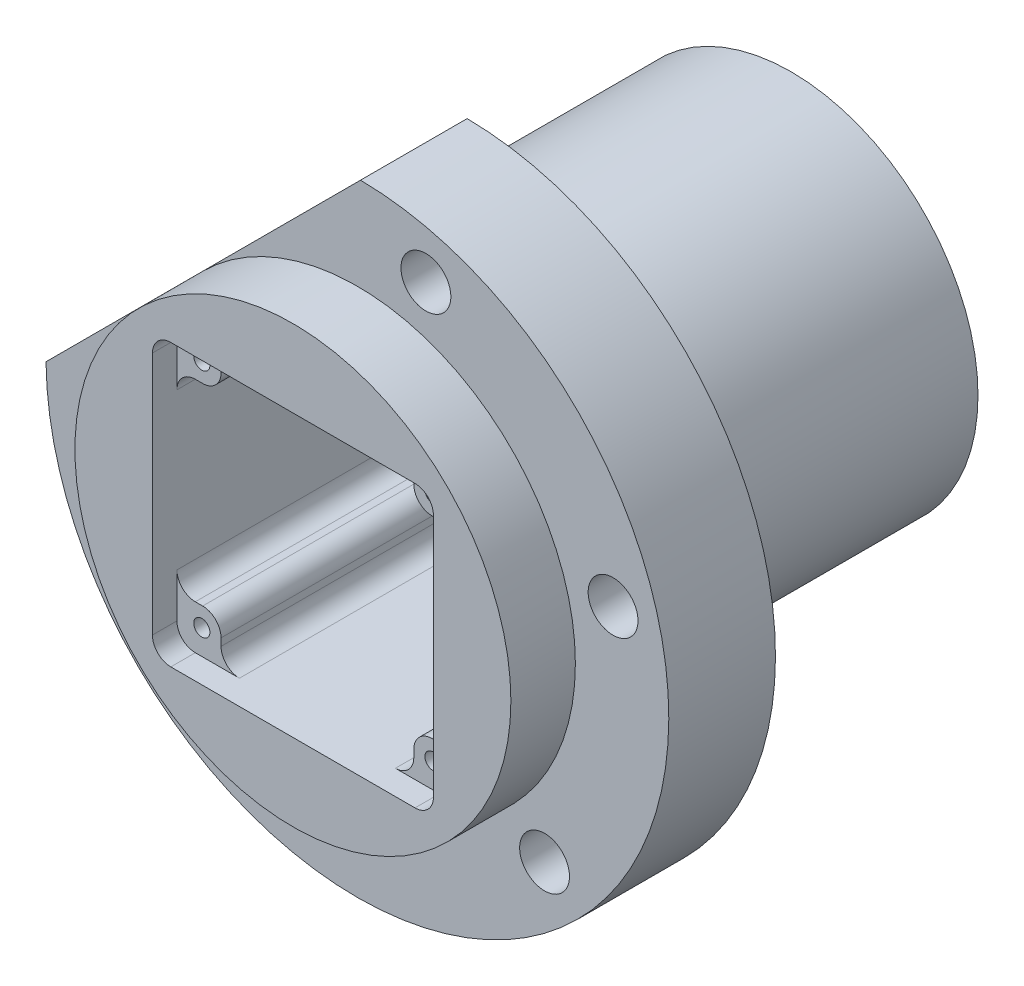
from build123d import *

# Parameters (mm, degrees)
SKETCH1_R                                     = 63.5
BOSS_EXTRUDE1_DEPTH                           = 6.35
BOSS_EXTRUDE2_START                           = 19.5
SKETCH1_3_R                                   = 44.45
BOSS_EXTRUDE2_DEPTH                           = 101.6
CUT_EXTRUDE1_DEPTH                            = 136.598893801
FILLET1_R                                     = 3.75
CUT_EXTRUDE2_DEPTH                            = 5
SKETCH4_R                                     = 63.5
SKETCH4_R_2                                   = 44.45
BOSS_EXTRUDE3_DEPTH                           = 15.4
CSK_FOR_8_FLAT_HEAD_MACHINE_SCREW1_AT_2_COUNT = 2
CSK_FOR_8_FLAT_HEAD_MACHINE_SCREW1_AT_2_PITCH = 53.975
CSK_FOR_8_FLAT_HEAD_MACHINE_SCREW1_AT_3_COUNT = 2
CSK_FOR_8_FLAT_HEAD_MACHINE_SCREW1_AT_3_PITCH = 93.487442339
CSK_FOR_8_FLAT_HEAD_MACHINE_SCREW1_AT_4_COUNT = 2
CSK_FOR_8_FLAT_HEAD_MACHINE_SCREW1_AT_4_PITCH = 107.95
CSK_FOR_8_FLAT_HEAD_MACHINE_SCREW1_AT_5_COUNT = 2
CSK_FOR_8_FLAT_HEAD_MACHINE_SCREW1_AT_5_PITCH = 93.487442339
CSK_FOR_8_FLAT_HEAD_MACHINE_SCREW1_AT_6_COUNT = 2
CSK_FOR_8_FLAT_HEAD_MACHINE_SCREW1_AT_6_PITCH = 53.975
CUT_EXTRUDE3_DEPTH                            = 127.047223293
SKETCH8_R                                     = 5.0856896
CUT_EXTRUDE4_DEPTH                            = 117.810059498
TAP_DRILL_FOR_M4X0_7_TAP1_D                   = 3.3
CUT_EXTRUDE5_START                            = -66.7
SKETCH12_R                                    = 44.45
SKETCH12_R_2                                  = 38.1
CUT_EXTRUDE5_DEPTH                            = 66.7


with BuildPart() as part:
    # Sketch1 → Boss-Extrude1 (new body)
    with BuildSketch(Plane.XY):
        Circle(SKETCH1_R)
    extrude(amount=BOSS_EXTRUDE1_DEPTH)

    # Sketch1<3> → Boss-Extrude2 (add)
    with BuildSketch(Plane.XY.offset(BOSS_EXTRUDE2_START)):
        Circle(SKETCH1_3_R)
    extrude(amount=-BOSS_EXTRUDE2_DEPTH)

    # Sketch2 → Cut-Extrude1 (cut, through all)
    with BuildSketch(Plane(origin=(0, 0, 19.5), x_dir=(-1, 0, 0), z_dir=(0, 0, -1))):
        Polygon((-19.65, 28.65), (-19.65, 19.65), (-28.65, 19.65), (-28.65, -19.65), (-19.65, -19.65), (-19.65, -28.65), (19.65, -28.65), (19.65, -19.65), (28.65, -19.65), (28.65, 19.65), (19.65, 19.65), (19.65, 28.65), align=None)
    extrude(amount=CUT_EXTRUDE1_DEPTH, mode=Mode.SUBTRACT)

    # Fillet1
    fillet1_edges = [part.edges().sort_by_distance(p)[0] for p in [
        (-19.65, 28.65, -31.3),
        (19.65, 28.65, -31.3),
        (19.65, 19.65, -31.3),
        (28.65, 19.65, -31.3),
        (28.65, -19.65, -31.3),
        (19.65, -19.65, -31.3),
        (19.65, -28.65, -31.3),
        (-19.65, -28.65, -31.3),
        (-19.65, -19.65, -31.3),
        (-28.65, -19.65, -31.3),
        (-28.65, 19.65, -31.3),
        (-19.65, 19.65, -31.3),
    ]]
    fillet(fillet1_edges, radius=FILLET1_R)

    # Sketch3 → Cut-Extrude2 (cut)
    with BuildSketch(Plane(origin=(0, 0, 19.5), x_dir=(-1, 0, 0), z_dir=(0, 0, -1))):
        with BuildLine():
            Line((-24.9, -28.65), (24.9, -28.65))
            ThreePointArc((24.9, -28.65), (27.551650429, -27.551650429), (28.65, -24.9))
            Line((28.65, -24.9), (28.65, 24.9))
            ThreePointArc((28.65, 24.9), (27.551650429, 27.551650429), (24.9, 28.65))
            Line((24.9, 28.65), (-24.9, 28.65))
            ThreePointArc((-24.9, 28.65), (-27.551650429, 27.551650429), (-28.65, 24.9))
            Line((-28.65, 24.9), (-28.65, -24.9))
            ThreePointArc((-28.65, -24.9), (-27.551650429, -27.551650429), (-24.9, -28.65))
        make_face()
    extrude(amount=CUT_EXTRUDE2_DEPTH, mode=Mode.SUBTRACT)

    # Sketch4 → Boss-Extrude3 (add)
    with BuildSketch(Plane(origin=(0, 0, 0), x_dir=(-1, 0, 0), z_dir=(0, 0, -1))):
        Circle(SKETCH4_R)
        with Locations(Location((0, 0, 0), (0, 0, 180))):
            Circle(SKETCH4_R_2, mode=Mode.SUBTRACT)
    extrude(amount=BOSS_EXTRUDE3_DEPTH)

    # Sketch7 → CSK for #8 Flat Head Machine Screw1 (revolve, cut)
    with BuildSketch(Plane(origin=(38.166088515, -38.166088515, -7.4), x_dir=(0, -1, 0), z_dir=(1, 0, 0))):
        Polygon((0, 0), (0, 74.7), (2.2479, 74.7), (2.2479, 3.264503502), (5.0856896, 0), align=None)
    csk_for_8_flat_head_machine_screw1 = revolve(axis=Axis((38.166088515, -38.166088515, -1.05), (0, 0, -1)), mode=Mode.SUBTRACT)

    # CSK for #8 Flat Head Machine Screw1 at 2: CSK for #8 Flat Head Machine Screw1 ×2
    with Locations(*[Vector(-0.9659258262890688, -0.25881904510251924, 0) * (i * CSK_FOR_8_FLAT_HEAD_MACHINE_SCREW1_AT_2_PITCH) for i in range(1, CSK_FOR_8_FLAT_HEAD_MACHINE_SCREW1_AT_2_COUNT)]):
        add(csk_for_8_flat_head_machine_screw1, mode=Mode.SUBTRACT)

    # CSK for #8 Flat Head Machine Screw1 at 3: CSK for #8 Flat Head Machine Screw1 ×2
    with Locations(*[Vector(-0.9659258262890679, 0.25881904510252224, 0) * (i * CSK_FOR_8_FLAT_HEAD_MACHINE_SCREW1_AT_3_PITCH) for i in range(1, CSK_FOR_8_FLAT_HEAD_MACHINE_SCREW1_AT_3_COUNT)]):
        add(csk_for_8_flat_head_machine_screw1, mode=Mode.SUBTRACT)

    # CSK for #8 Flat Head Machine Screw1 at 4: CSK for #8 Flat Head Machine Screw1 ×2
    with Locations(*[Vector(-0.7071067811865464, 0.7071067811865487, 0) * (i * CSK_FOR_8_FLAT_HEAD_MACHINE_SCREW1_AT_4_PITCH) for i in range(1, CSK_FOR_8_FLAT_HEAD_MACHINE_SCREW1_AT_4_COUNT)]):
        add(csk_for_8_flat_head_machine_screw1, mode=Mode.SUBTRACT)

    # CSK for #8 Flat Head Machine Screw1 at 5: CSK for #8 Flat Head Machine Screw1 ×2
    with Locations(*[Vector(-0.2588190451025193, 0.9659258262890688, 0) * (i * CSK_FOR_8_FLAT_HEAD_MACHINE_SCREW1_AT_5_PITCH) for i in range(1, CSK_FOR_8_FLAT_HEAD_MACHINE_SCREW1_AT_5_COUNT)]):
        add(csk_for_8_flat_head_machine_screw1, mode=Mode.SUBTRACT)

    # CSK for #8 Flat Head Machine Screw1 at 6: CSK for #8 Flat Head Machine Screw1 ×2
    with Locations(*[Vector(0.25881904510252257, 0.9659258262890679, 0) * (i * CSK_FOR_8_FLAT_HEAD_MACHINE_SCREW1_AT_6_PITCH) for i in range(1, CSK_FOR_8_FLAT_HEAD_MACHINE_SCREW1_AT_6_COUNT)]):
        add(csk_for_8_flat_head_machine_screw1, mode=Mode.SUBTRACT)

    # Sketch5 → Cut-Extrude3 (cut, through all)
    with BuildSketch(Plane.XY.offset(6.35)):
        with BuildLine():
            Line((-63.496824603, -0.635031756), (0.635031756, 63.496824603))
            ThreePointArc((0.635031756, 63.496824603), (-44.901280605, 44.901280605), (-63.496824603, -0.635031756))
        make_face()
    extrude(amount=-CUT_EXTRUDE3_DEPTH, mode=Mode.SUBTRACT)

    # Sketch8 → Cut-Extrude4 (cut, through all)
    with BuildSketch(Plane(origin=(0, 0, -7.4), x_dir=(-1, 0, 0), z_dir=(0, 0, -1))):
        with Locations((-38.166088515, -38.166088515)):
            Circle(SKETCH8_R)
        with Locations((52.135846474, -13.969757959)):
            Circle(SKETCH8_R)
        with Locations((13.969757959, -52.135846474)):
            Circle(SKETCH8_R)
        with Locations((-52.135846474, 13.969757959)):
            Circle(SKETCH8_R)
        with Locations((-13.969757959, 52.135846474)):
            Circle(SKETCH8_R)
    extrude(amount=-CUT_EXTRUDE4_DEPTH, mode=Mode.SUBTRACT)

    # Tap Drill for M4x0.7 Tap1 (through all)
    with Locations(Plane.XY.offset(14.5)):
        with Locations((-23.57, 23.57), (23.57, 23.57), (23.57, -23.57), (-23.57, -23.57)):
            Hole(TAP_DRILL_FOR_M4X0_7_TAP1_D / 2)

    # Sketch12 → Cut-Extrude5 (cut)
    with BuildSketch(Plane(origin=(0, 0, -82.1), x_dir=(-1, 0, 0), z_dir=(0, 0, -1)).offset(CUT_EXTRUDE5_START)):
        with Locations(Location((0, 0, 0), (0, 0, 180))):
            Circle(SKETCH12_R)
        Circle(SKETCH12_R_2, mode=Mode.SUBTRACT)
    extrude(amount=CUT_EXTRUDE5_DEPTH, mode=Mode.SUBTRACT)


solid = part.part
